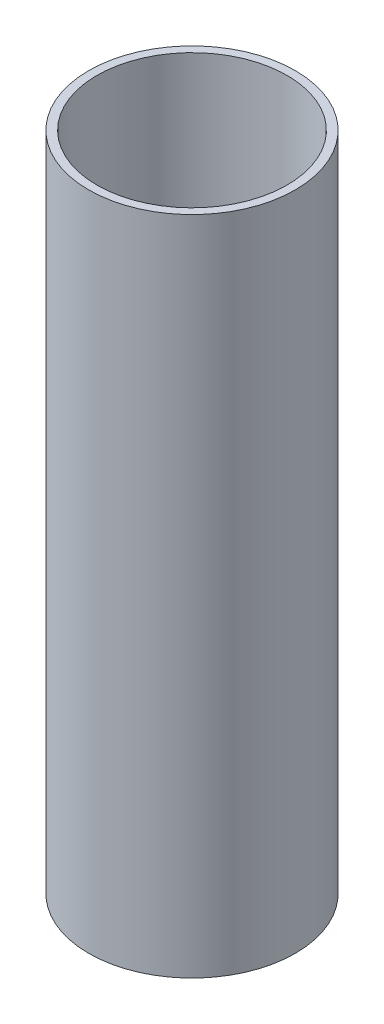
from build123d import *

# Parameters (mm, degrees)
SKETCH1_R           = 12.5
SKETCH1_R_2         = 11.5
BOSS_EXTRUDE1_DEPTH = 80


with BuildPart() as part:
    # Sketch1 → Boss-Extrude1 (new body)
    with BuildSketch(Plane(origin=(0, 0, 0), x_dir=(1, 0, 0), z_dir=(0, 1, 0))):
        with Locations(Location((0, 0, 0), (0, 0, 270))):
            Circle(SKETCH1_R)
        with Locations(Location((0, 0, 0), (0, 0, 270))):
            Circle(SKETCH1_R_2, mode=Mode.SUBTRACT)
    extrude(amount=BOSS_EXTRUDE1_DEPTH)


solid = part.part
